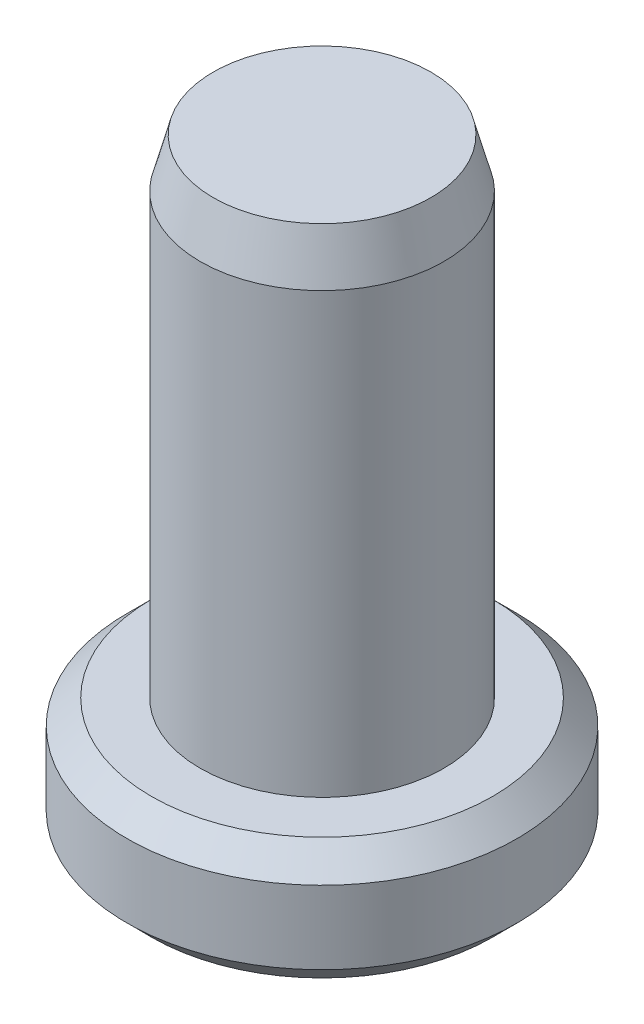
from build123d import *

# Parameters (mm, degrees)
SKETCH1_R           = 5
BOSS_EXTRUDE1_DEPTH = 20
CHAMFER1_SIZE       = 2
CHAMFER1_SIZE2      = 0.535898385
SKETCH2_R           = 8
BOSS_EXTRUDE2_DEPTH = 5
CHAMFER2_SIZE       = 1


with BuildPart() as part:
    # Sketch1 → Boss-Extrude1 (new body)
    with BuildSketch(Plane(origin=(0, 0, 0), x_dir=(1, 0, 0), z_dir=(0, 1, 0))):
        with Locations(Location((0, 0, 0), (0, 0, 270))):
            Circle(SKETCH1_R)
    extrude(amount=BOSS_EXTRUDE1_DEPTH)

    # Chamfer1
    chamfer1_edges = [part.edges().sort_by_distance(p)[0] for p in [
        (0, 20, -5),
    ]]
    chamfer1_side = [part.faces().sort_by_distance(p)[0] for p in [
        (0, 10, -5),
    ]]
    chamfer(chamfer1_edges, length=CHAMFER1_SIZE, length2=CHAMFER1_SIZE2, reference=chamfer1_side[0])

    # Sketch2 → Boss-Extrude2 (add)
    with BuildSketch(Plane.XZ):
        with Locations(Location((0, 0, 0), (0, 0, 270))):
            Circle(SKETCH2_R)
    extrude(amount=BOSS_EXTRUDE2_DEPTH)

    # Chamfer2
    chamfer2_edges = [part.edges().sort_by_distance(p)[0] for p in [
        (0, 0, 8),
        (0, -5, 8),
    ]]
    chamfer(chamfer2_edges, length=CHAMFER2_SIZE)


solid = part.part
